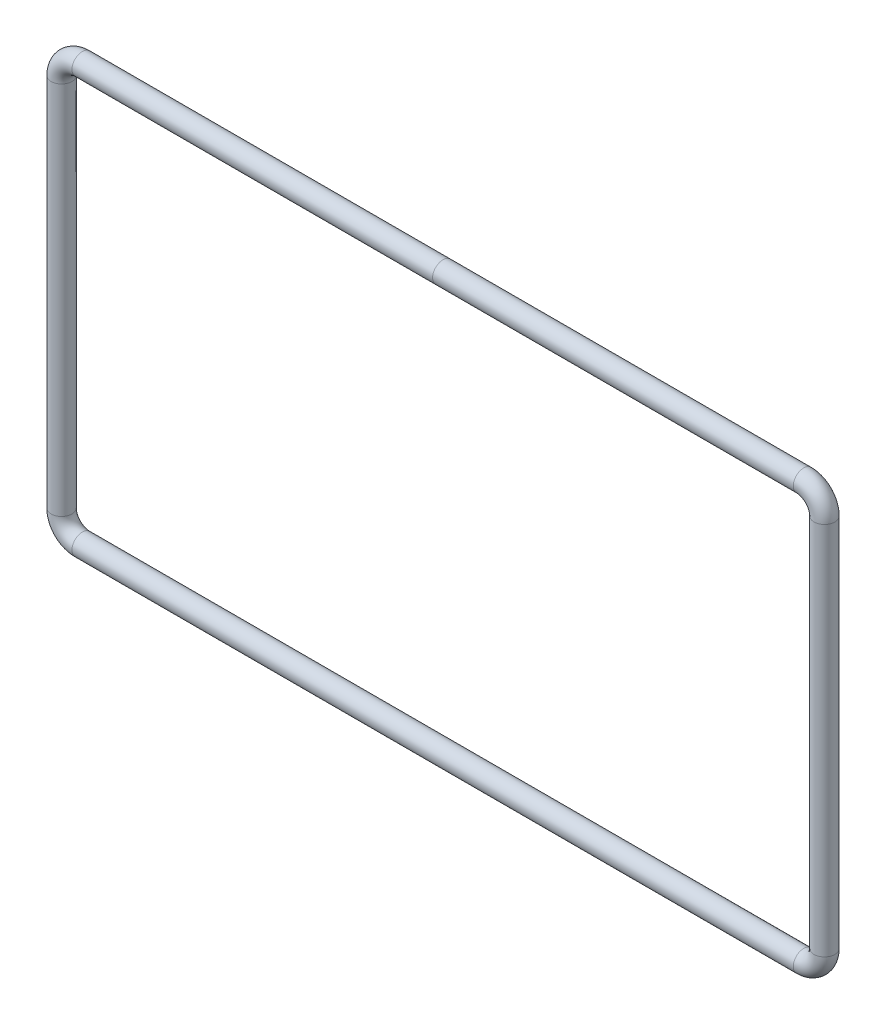
from build123d import *

# Parameters (mm, degrees)
ESBO_O2_R = 2.1


with BuildPart() as part:
    # Varredura1: sweep along a path in Esboço1
    with BuildLine(Plane.XY) as varredura1_path:
        Line((72.8, -42), (-72.8, -42))
        ThreePointArc((-72.8, -42), (-75.769848481, -40.769848481), (-77, -37.8))
        Line((-77, -37.8), (-77, 37.8))
        ThreePointArc((-77, 37.8), (-75.769848481, 40.769848481), (-72.8, 42))
        Line((-72.8, 42), (72.8, 42))
        ThreePointArc((72.8, 42), (75.769848481, 40.769848481), (77, 37.8))
        Line((77, 37.8), (77, -37.8))
        ThreePointArc((77, -37.8), (75.769848481, -40.769848481), (72.8, -42))
    # Esboço2 → Varredura1 (sweep)
    with BuildSketch(Plane(origin=(0, 0, 0), x_dir=(0, 0, -1), z_dir=(1, 0, 0))):
        with Locations((0, 42)):
            Circle(ESBO_O2_R)
    sweep(path=varredura1_path.line)


solid = part.part
